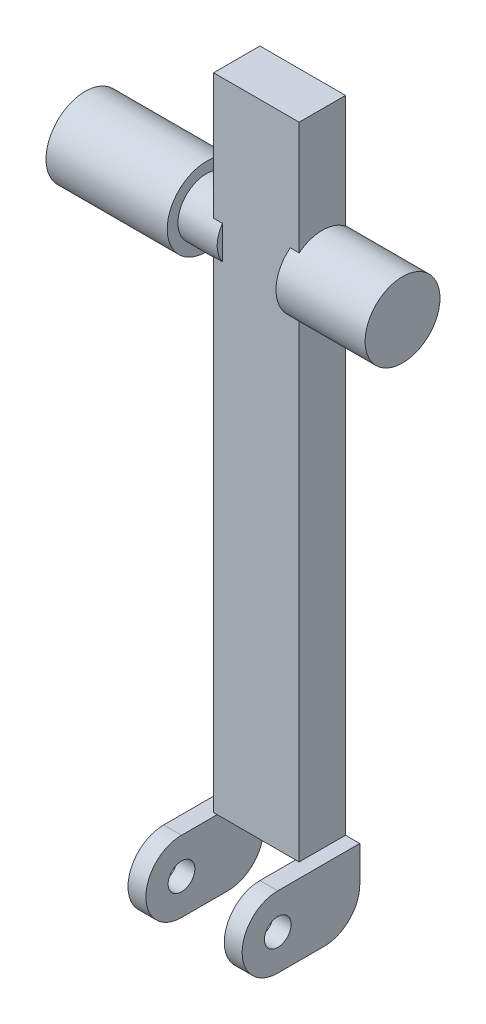
from build123d import *

# Parameters (mm, degrees)
SKETCH3_R                = 16
BOSS_EXTRUDE1_DEPTH      = 22
SKETCH4_R                = 22
BOSS_EXTRUDE2_DEPTH      = 68
SKETCH2_R                = 21
BOSS_EXTRUDE3_DEPTH      = 50
BOSS_EXTRUDE5_DEPTH      = 80
BOSS_EXTRUDE5_DEPTH_BACK = 279.4
SKETCH1_W                = 48
SKETCH1_H                = 26
BOSS_EXTRUDE7_START      = -2
BOSS_EXTRUDE7_DEPTH      = 10
CUT_EXTRUDE4_START       = -10
SKETCH10_R               = 7.5
CUT_EXTRUDE4_DEPTH       = 10


with BuildPart() as part:
    # Sketch3 → Boss-Extrude1 (new body)
    with BuildSketch(Plane(origin=(-19, 0, 0), x_dir=(0, 0, -1), z_dir=(1, 0, 0))):
        Circle(SKETCH3_R)
    extrude(amount=-BOSS_EXTRUDE1_DEPTH)

    # Sketch4 → Boss-Extrude2 (add)
    with BuildSketch(Plane.ZY.offset(41)):
        Circle(SKETCH4_R)
    extrude(amount=BOSS_EXTRUDE2_DEPTH)



with BuildPart() as body_2:
    # Sketch2 → Boss-Extrude3 (new body)
    with BuildSketch(Plane(origin=(19, 0, 0), x_dir=(0, 0, -1), z_dir=(1, 0, 0))):
        Circle(SKETCH2_R)
    extrude(amount=BOSS_EXTRUDE3_DEPTH)


with BuildPart() as part_1:
    add(part.part)

    add(body_2.part)  # Boss-Extrude5 merges body 2
    # Sketch1 → Boss-Extrude5 (add, two sides: drawn at the far end of the back side and taken through both)
    with BuildSketch(Plane(origin=(0, 0, 0), x_dir=(1, 0, 0), z_dir=(0, 1, 0)).offset(-BOSS_EXTRUDE5_DEPTH_BACK)):
        Rectangle(SKETCH1_W, SKETCH1_H)
    extrude(amount=BOSS_EXTRUDE5_DEPTH + BOSS_EXTRUDE5_DEPTH_BACK)


with BuildPart() as body_2_2:
    # Sketch5 → Boss-Extrude7 (new body)
    with BuildSketch(Plane(origin=(24, 0, 0), x_dir=(0, 0, -1), z_dir=(1, 0, 0)).offset(BOSS_EXTRUDE7_START)):
        with BuildLine():
            Line((13, -279.4), (-33, -279.4))
            ThreePointArc((-33, -279.4), (-53, -299.4), (-33, -319.4))
            Line((-33, -319.4), (-7, -319.4))
            ThreePointArc((-7, -319.4), (7.142135624, -313.542135624), (13, -299.4))
            Line((13, -299.4), (13, -279.4))
        make_face()
    boss_extrude7 = extrude(amount=BOSS_EXTRUDE7_DEPTH)

    # Sketch10 → Cut-Extrude4 (cut)
    with BuildSketch(Plane.ZY.offset(-22).offset(CUT_EXTRUDE4_START)):
        with Locations((33, -299.4)):
            Circle(SKETCH10_R)
    cut_extrude4 = extrude(amount=CUT_EXTRUDE4_DEPTH, mode=Mode.SUBTRACT)


with BuildPart() as part_2:
    add(part_1.part)

    # Mirror26: Boss-Extrude7, Cut-Extrude4 across plane
    add(boss_extrude7.mirror(Plane(origin=(0, 0, 0), x_dir=(0, 0, 1), z_dir=(1, 0, 0))))
    add(cut_extrude4.mirror(Plane(origin=(0, 0, 0), x_dir=(0, 0, 1), z_dir=(1, 0, 0))), mode=Mode.SUBTRACT)


solid = Compound([body_2_2.part, part_2.part])
